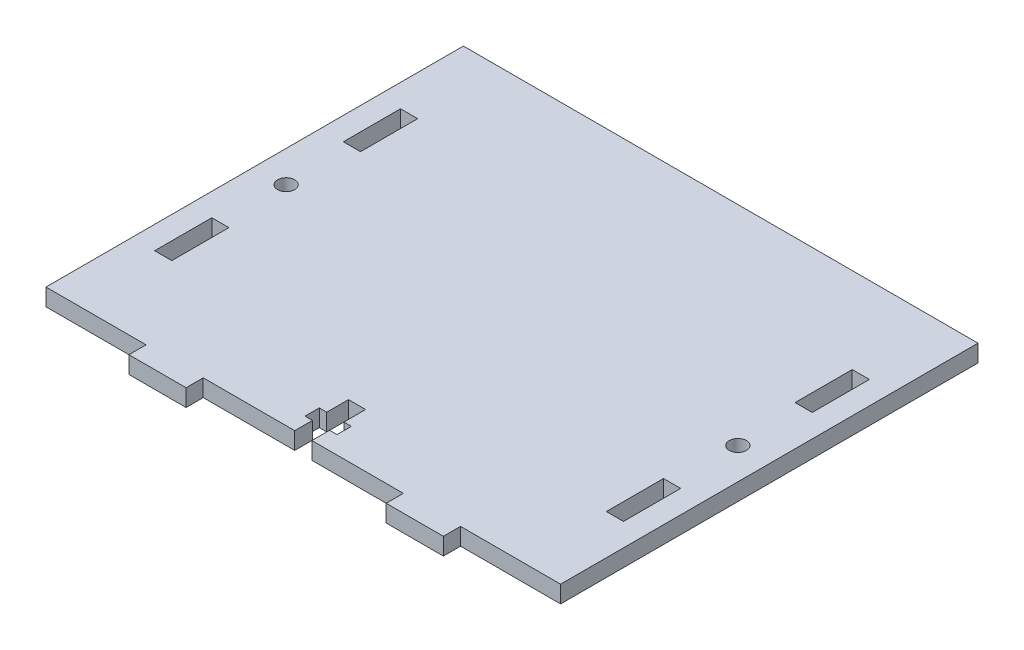
from build123d import *

# Parameters (mm, degrees)
SKETCH1_W           = 3
SKETCH1_H           = 10
SKETCH1_R           = 1.5
BOSS_EXTRUDE1_DEPTH = 3


with BuildPart() as part:
    # Sketch1 → Boss-Extrude1 (new body)
    # profile 1 of 2: a face of its own
    with BuildSketch(Plane(origin=(0, 0, 0), x_dir=(1, 0, 0), z_dir=(0, 1, 0))):
        Polygon((-90, 0), (-72.5, 0), (-72.5, -3), (-62.5, -3), (-62.5, 0), (-46.5, 0), (-46.5, 3.1), (-47.8, 3.1), (-47.8, 5.6), (-46.5, 5.6), (-46.5, 9.4), (-45, 9.4), (-45, 73), (-90, 73), align=None)
        with Locations((-84.5, 20)):
            Rectangle(SKETCH1_W, SKETCH1_H, mode=Mode.SUBTRACT)
        with Locations(Location((-84.5, 36.5, 0), (0, 0, 270))):
            Circle(SKETCH1_R, mode=Mode.SUBTRACT)
        with Locations((-84.5, 53)):
            Rectangle(SKETCH1_W, SKETCH1_H, mode=Mode.SUBTRACT)
    # profile 2 of 2: a face of its own
    with BuildSketch(Plane(origin=(0, 0, 0), x_dir=(1, 0, 0), z_dir=(0, 1, 0))):
        Polygon((0, 73), (-45, 73), (-45, 9.4), (-43.5, 9.4), (-43.5, 5.6), (-42.2, 5.6), (-42.2, 3.1), (-43.5, 3.1), (-43.5, 0), (-27.5, 0), (-27.5, -3), (-17.5, -3), (-17.5, 0), (0, 0), align=None)
        with Locations((-5.5, 20)):
            Rectangle(SKETCH1_W, SKETCH1_H, mode=Mode.SUBTRACT)
        with Locations(Location((-5.5, 36.5, 0), (0, 0, 270))):
            Circle(SKETCH1_R, mode=Mode.SUBTRACT)
        with Locations((-5.5, 53)):
            Rectangle(SKETCH1_W, SKETCH1_H, mode=Mode.SUBTRACT)
    extrude(amount=BOSS_EXTRUDE1_DEPTH)


solid = part.part
